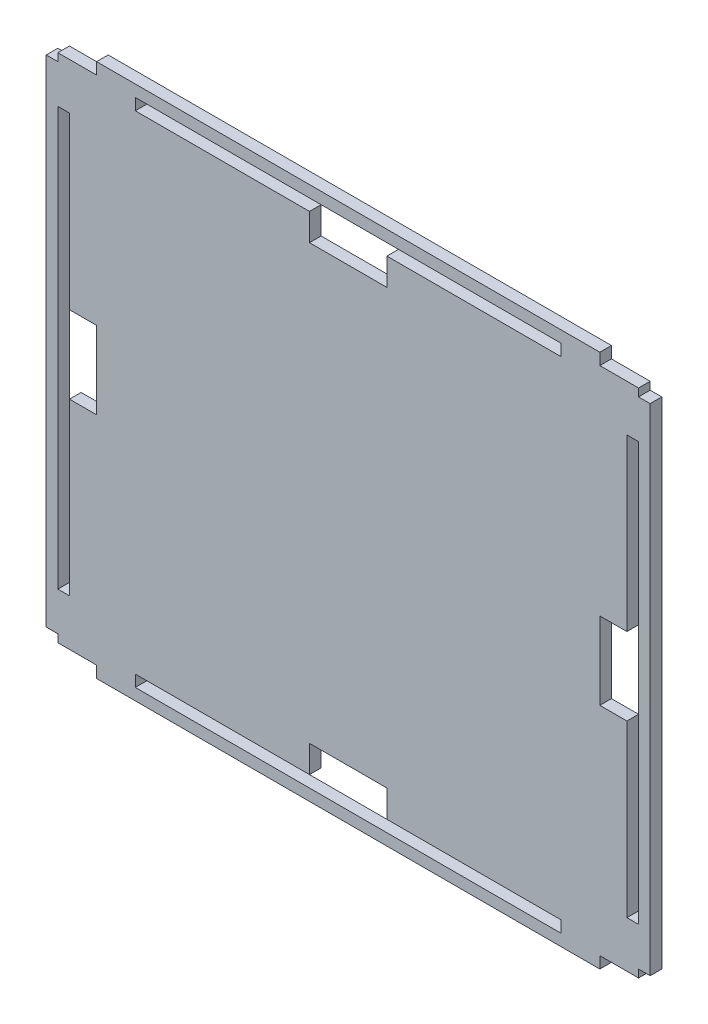
from build123d import *

# Parameters (mm, degrees)
BOSS_EXTRUDE1_DEPTH = 3


with BuildPart() as part:
    # Sketch1 → Boss-Extrude1 (new body)
    with BuildSketch(Plane.XY):
        Polygon((46.640816327, 44.833717619), (-83.359183673, 44.833717619), (-83.359183673, 41.833717619), (-93.359183673, 41.833717619), (-93.359183673, 39.833717619), (-96.359183673, 39.833717619), (-96.359183673, -88.166282381), (-93.359183673, -88.166282381), (-93.359183673, -90.166282381), (-83.359183673, -90.166282381), (-83.359183673, -93.166282381), (46.640816327, -93.166282381), (46.640816327, -90.166282381), (56.640816327, -90.166282381), (56.640816327, -88.166282381), (59.640816327, -88.166282381), (59.640816327, 39.833717619), (56.640816327, 39.833717619), (56.640816327, 41.833717619), (46.640816327, 41.833717619), align=None)
        Polygon((-8.359183673, -80.166282381), (-8.359183673, -87.166282381), (36.640816327, -87.166282381), (36.640816327, -90.166282381), (-73.359183673, -90.166282381), (-73.359183673, -87.166282381), (-28.359183673, -87.166282381), (-28.359183673, -80.166282381), align=None, mode=Mode.SUBTRACT)
        Polygon((-93.359183673, -78.166282381), (-93.359183673, 29.833717619), (-90.359183673, 29.833717619), (-90.359183673, -14.166282381), (-83.359183673, -14.166282381), (-83.359183673, -34.166282381), (-90.359183673, -34.166282381), (-90.359183673, -78.166282381), align=None, mode=Mode.SUBTRACT)
        Polygon((-73.359183673, 38.833717619), (-73.359183673, 41.833717619), (36.640816327, 41.833717619), (36.640816327, 38.833717619), (-8.359183673, 38.833717619), (-8.359183673, 31.833717619), (-28.359183673, 31.833717619), (-28.359183673, 38.833717619), align=None, mode=Mode.SUBTRACT)
        Polygon((46.640816327, -34.166282381), (46.640816327, -14.166282381), (53.640816327, -14.166282381), (53.640816327, 29.833717619), (56.640816327, 29.833717619), (56.640816327, -78.166282381), (53.640816327, -78.166282381), (53.640816327, -34.166282381), align=None, mode=Mode.SUBTRACT)
    extrude(amount=BOSS_EXTRUDE1_DEPTH)


solid = part.part
